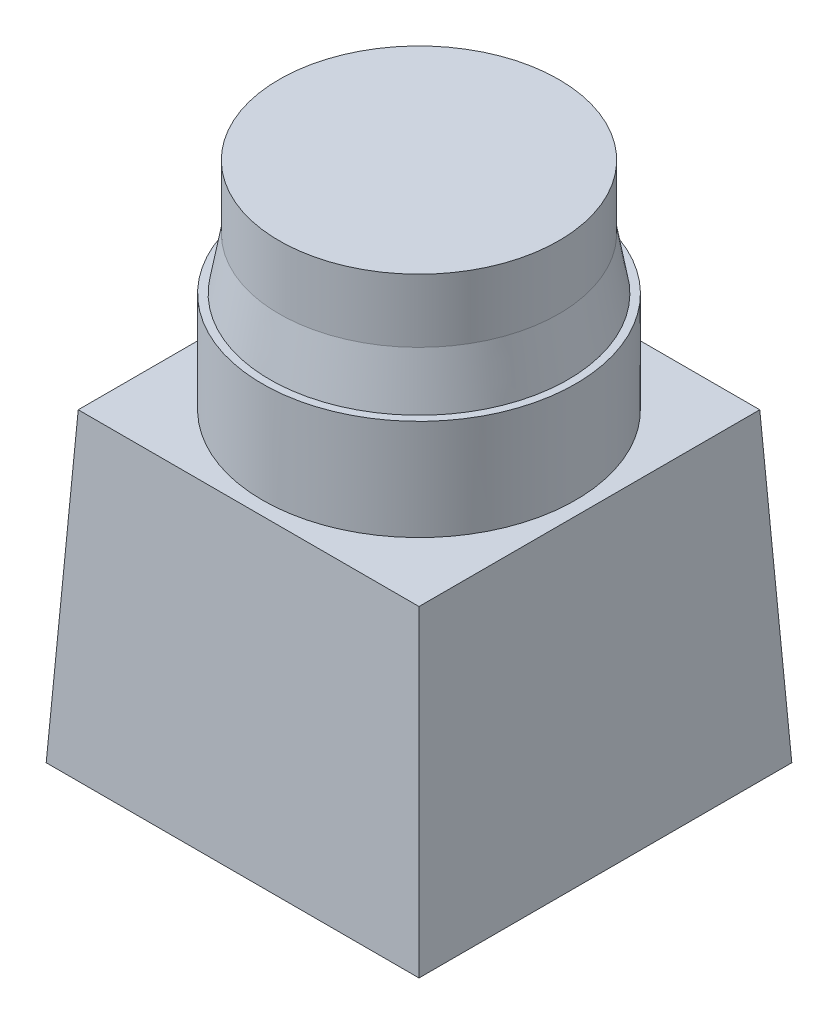
from build123d import *

# Parameters (mm, degrees)
ESBO_O1_W                = 50
ESBO_O1_H                = 50
RESSALTO_EXTRUS_O1_DEPTH = 41
RESSALTO_EXTRUS_O1_TAPER = 3


with BuildPart() as part:
    # Esboço1 → Ressalto-extrusão1 (new body)
    with BuildSketch(Plane(origin=(0, 0, 0), x_dir=(1, 0, 0), z_dir=(0, 1, 0))):
        Rectangle(ESBO_O1_W, ESBO_O1_H)
    extrude(amount=RESSALTO_EXTRUS_O1_DEPTH, taper=RESSALTO_EXTRUS_O1_TAPER)

    # Esboço2 → Revolução1 (revolve)
    with BuildSketch(Plane(origin=(0, 0, 0), x_dir=(0, 0, -1), z_dir=(1, 0, 0))):
        Polygon((0, 41), (0, 70), (18.75, 70), (18.75, 61.5), (20, 54.5), (21, 54.5), (21, 41), align=None)
    revolve(axis=Axis((0, 41, 0), (0, 1, 0)))


solid = part.part
